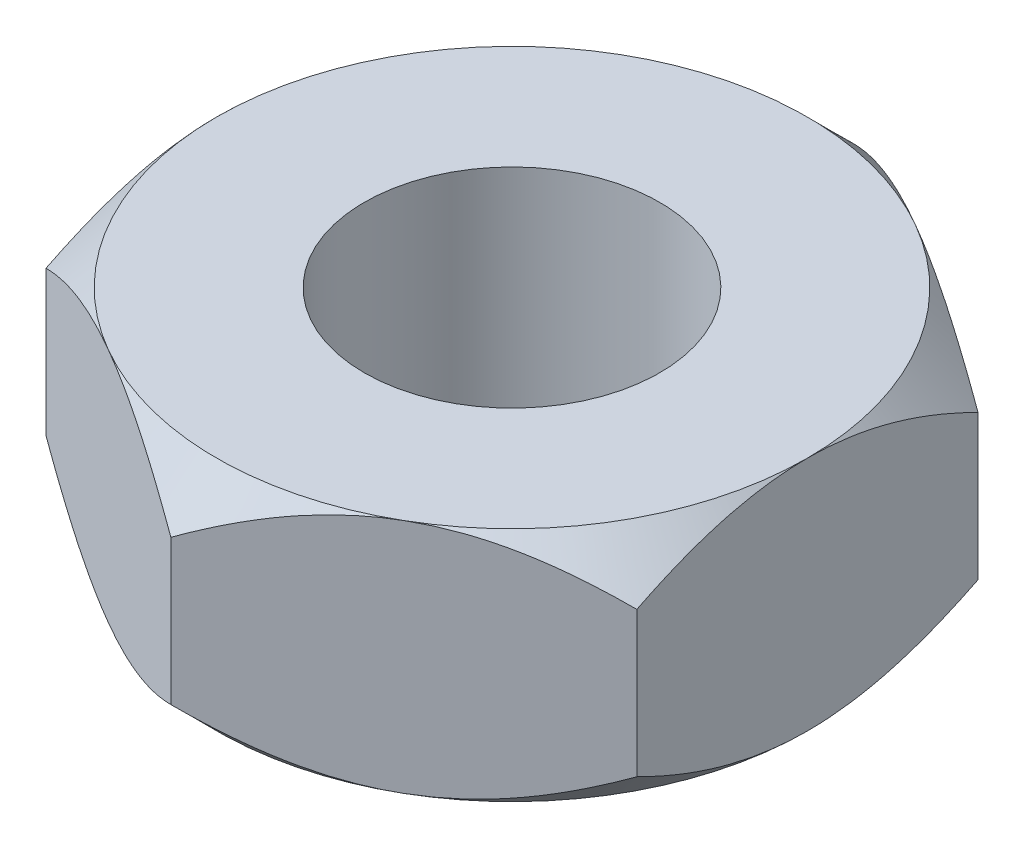
from build123d import *

# Parameters (mm, degrees)
SKETCH1_R               = 1
BOSS_EXTRUDE1_DEPTH     = 0.8
SKETCH4_OUTSIDE_W       = 10.464
SKETCH4_OUTSIDE_H       = 11.082
SKETCH4_OUTSIDE_R       = 2
CUT_EXTRUDE1_DEPTH      = 1.6
CUT_EXTRUDE1_DRAFT      = -45
MIRROR1_COPY_1_SKETCH_W = 10.464
MIRROR1_COPY_1_SKETCH_H = 11.082
MIRROR1_COPY_1_SKETCH_R = 2
MIRROR1_COPY_1_DEPTH    = 1.6
MIRROR1_COPY_1_DRAFT    = -45


with BuildPart() as part:
    # Sketch1 → Boss-Extrude1 (new, symmetric)
    with BuildSketch(Plane(origin=(0, 0, 0), x_dir=(1, 0, 0), z_dir=(0, 1, 0))):
        Polygon((0, -2.309401077), (2, -1.154700538), (2, 1.154700538), (0, 2.309401077), (-2, 1.154700538), (-2, -1.154700538), align=None)
        with Locations(Location((0, 0, 0), (0, 0, 270))):
            Circle(SKETCH1_R, mode=Mode.SUBTRACT)
    extrude(amount=BOSS_EXTRUDE1_DEPTH, both=True)


with BuildPart() as cut_extrude1_tool:
    # Sketch4 outside → Cut-Extrude1 (with draft: the straight prism first)
    with BuildSketch(Plane(origin=(0, 0.8, 0), x_dir=(1, 0, 0), z_dir=(0, 1, 0))):
        Rectangle(SKETCH4_OUTSIDE_W, SKETCH4_OUTSIDE_H)
        Circle(SKETCH4_OUTSIDE_R, mode=Mode.SUBTRACT)
    extrude(amount=-CUT_EXTRUDE1_DEPTH)
    # Cut-Extrude1: the draft: its side faces are tilted about the plane it starts from
    cut_extrude1_sides = [cut_extrude1_tool.faces().sort_by_distance(p)[0] for p in [
        (0, 0, 5.541),
        (5.232, 0, 0),
        (0, 0, -5.541),
        (-5.232, 0, 0),
        (-2, 0, 0),
    ]]
    draft(cut_extrude1_sides, Plane(origin=(0, 0.8, 0), x_dir=(1, 0, 0), z_dir=(0, 1, 0)), CUT_EXTRUDE1_DRAFT)


with BuildPart() as part_1:
    add(part.part)

    # Cut-Extrude1: cut by cut_extrude1_tool
    add(cut_extrude1_tool.part, mode=Mode.SUBTRACT)


with BuildPart() as mirror1_copy_1_tool:
    # Mirror1 copy 1 sketch → Mirror1 copy 1 (with draft: the straight prism first)
    with BuildSketch(Plane.XZ.offset(0.8)):
        Rectangle(MIRROR1_COPY_1_SKETCH_W, MIRROR1_COPY_1_SKETCH_H)
        Circle(MIRROR1_COPY_1_SKETCH_R, mode=Mode.SUBTRACT)
    extrude(amount=-MIRROR1_COPY_1_DEPTH)
    # Mirror1 copy 1: the draft: its side faces are tilted about the plane it starts from
    mirror1_copy_1_sides = [mirror1_copy_1_tool.faces().sort_by_distance(p)[0] for p in [
        (0, 0, 5.541),
        (5.232, 0, 0),
        (0, 0, -5.541),
        (-5.232, 0, 0),
        (-2, 0, 0),
    ]]
    draft(mirror1_copy_1_sides, Plane.XZ.offset(0.8), MIRROR1_COPY_1_DRAFT)


with BuildPart() as part_2:
    add(part_1.part)

    # Mirror1 copy 1: cut by mirror1_copy_1_tool
    add(mirror1_copy_1_tool.part, mode=Mode.SUBTRACT)


solid = part_2.part
